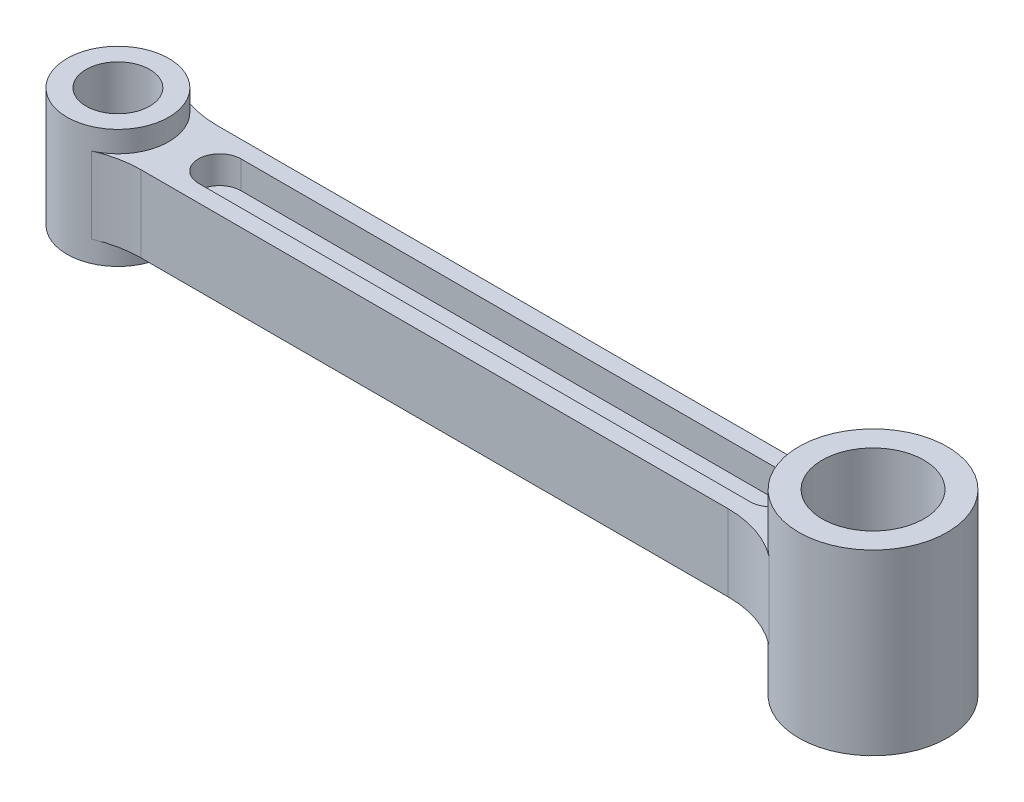
from build123d import *

# Parameters (mm, degrees)
SKETCH1_R           = 12
BOSS_EXTRUDE4_DEPTH = 21
SKETCH1_6_R         = 7.5
BOSS_EXTRUDE5_DEPTH = 14
BOSS_EXTRUDE6_DEPTH = 9
BOSS_EXTRUDE7_DEPTH = 2.5


with BuildPart() as part:
    # Sketch1 → Boss-Extrude4 (new, symmetric)
    with BuildSketch(Plane(origin=(0, 0, 0), x_dir=(1, 0, 0), z_dir=(0, 1, 0))):
        with BuildLine():
            ThreePointArc((167.388481117, -13.915662651), (195.5, 0), (167.388481117, 13.915662651))
            ThreePointArc((167.388481117, 13.915662651), (160.5, 0), (167.388481117, -13.915662651))
        make_face()
        with Locations((178, 0)):
            Circle(SKETCH1_R, mode=Mode.SUBTRACT)
    extrude(amount=BOSS_EXTRUDE4_DEPTH, both=True)



with BuildPart() as body_2:
    # Sketch1<6> → Boss-Extrude5 (new, symmetric)
    with BuildSketch(Plane(origin=(0, 0, 0), x_dir=(1, 0, 0), z_dir=(0, 1, 0))):
        with BuildLine():
            ThreePointArc((4.795831523, -11), (12, 0), (4.795831523, 11))
            ThreePointArc((4.795831523, 11), (-12, 0), (4.795831523, -11))
        make_face()
        Circle(SKETCH1_6_R, mode=Mode.SUBTRACT)
    extrude(amount=BOSS_EXTRUDE5_DEPTH, both=True)


with BuildPart() as part_1:
    add(part.part)

    add(body_2.part)  # Boss-Extrude6 merges body 2
    # Sketch1<7> → Boss-Extrude6 (add, symmetric)
    with BuildSketch(Plane(origin=(0, 0, 0), x_dir=(1, 0, 0), z_dir=(0, 1, 0))):
        with BuildLine():
            Line((152.835540936, 9), (14.38749457, 9))
            ThreePointArc((14.38749457, 9), (9.488515084, 9.505319751), (4.795831523, 11))
            ThreePointArc((4.795831523, 11), (12, 0), (4.795831523, -11))
            ThreePointArc((4.795831523, -11), (9.488515084, -9.505319751), (14.38749457, -9))
            Line((14.38749457, -9), (152.835540936, -9))
            ThreePointArc((152.835540936, -9), (160.515902373, -10.26210106), (167.388481117, -13.915662651))
            ThreePointArc((167.388481117, -13.915662651), (160.5, 0), (167.388481117, 13.915662651))
            ThreePointArc((167.388481117, 13.915662651), (160.515902373, 10.26210106), (152.835540936, 9))
        make_face()
        with BuildLine():
            ThreePointArc((24, -5), (19, 0), (24, 5))
            Line((24, 5), (154, 5))
            ThreePointArc((154, 5), (159, 0), (154, -5))
            Line((154, -5), (24, -5))
        make_face(mode=Mode.SUBTRACT)
    extrude(amount=BOSS_EXTRUDE6_DEPTH, both=True)

    # Sketch1<8> → Boss-Extrude7 (add, symmetric)
    with BuildSketch(Plane(origin=(0, 0, 0), x_dir=(1, 0, 0), z_dir=(0, 1, 0))):
        with BuildLine():
            Line((154, 5), (24, 5))
            ThreePointArc((24, 5), (19, 0), (24, -5))
            Line((24, -5), (154, -5))
            ThreePointArc((154, -5), (159, 0), (154, 5))
        make_face()
    extrude(amount=BOSS_EXTRUDE7_DEPTH, both=True)


solid = part_1.part
